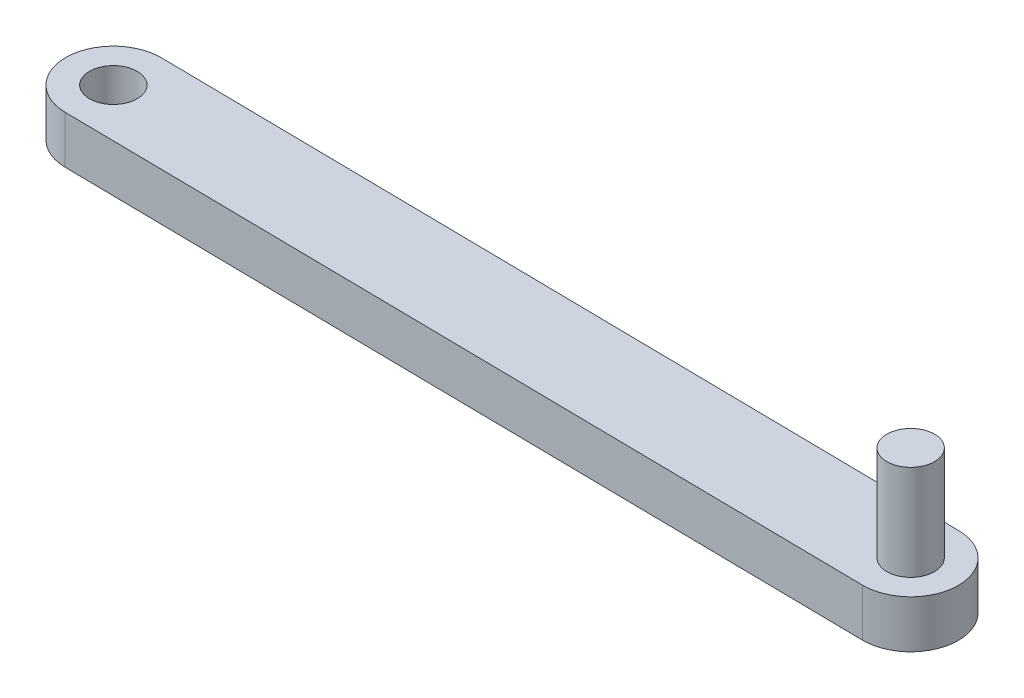
from build123d import *

# Parameters (mm, degrees)
SKETCH1_R           = 2.5
BOSS_EXTRUDE1_DEPTH = 5
SKETCH2_R           = 2.5
BOSS_EXTRUDE2_DEPTH = 10


with BuildPart() as part:
    # Sketch1 → Boss-Extrude1 (new body)
    with BuildSketch(Plane(origin=(0, 0, 0), x_dir=(1, 0, 0), z_dir=(0, 1, 0))):
        with BuildLine():
            Line((-14.504443595, 6.706697569), (70.295556405, 5.56735016))
            ThreePointArc((70.295556405, 5.56735016), (75.22793273, 0.500628954), (70.161211524, -4.431747372))
            Line((70.161211524, -4.431747372), (-14.638788476, -3.292399963))
            ThreePointArc((-14.638788476, -3.292399963), (-19.571164802, 1.774321243), (-14.504443595, 6.706697569))
        make_face()
        with Locations(Location((-14.571616036, 1.707148803, 0), (0, 0, 270))):
            Circle(SKETCH1_R, mode=Mode.SUBTRACT)
    extrude(amount=BOSS_EXTRUDE1_DEPTH)

    # Sketch2 → Boss-Extrude2 (add)
    with BuildSketch(Plane(origin=(0, 5, 0), x_dir=(1, 0, 0), z_dir=(0, 1, 0))):
        with Locations(Location((70.228383964, 0.567801394, 0), (0, 0, 270))):
            Circle(SKETCH2_R)
    extrude(amount=BOSS_EXTRUDE2_DEPTH)


solid = part.part
